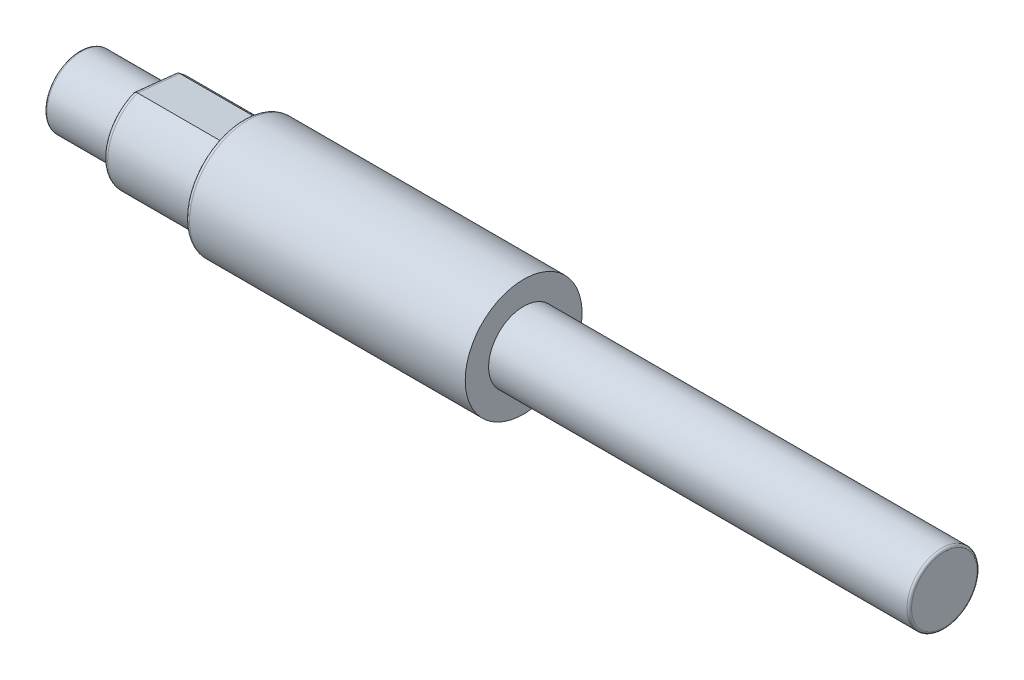
from build123d import *

# Parameters (mm, degrees)
SKETCH_1_R      = 1.5
EXTRUDE_1_DEPTH = 37
EXTRUDE_START   = -7
SKETCH_2_R      = 2.5
SKETCH_2_R_2    = 1
EXTRUDE_2_DEPTH = 12
EXTRUDE_START_2 = 3
SKETCH_3_R      = 1
EXTRUDE_4_DEPTH = 4
FILLET_1_R      = 0.1
FILLET_2_R      = 0.2


with BuildPart() as part:
    # 草图1 → 凸台-拉伸1 (new body)
    with BuildSketch(Plane(origin=(0, 0, 0), x_dir=(0, 0, -1), z_dir=(1, 0, 0))):
        Circle(SKETCH_1_R)
    extrude(amount=EXTRUDE_1_DEPTH)

    # 草图2 → 凸台-拉伸2 (add)
    with BuildSketch(Plane.ZY.offset(EXTRUDE_START)):
        Circle(SKETCH_2_R)
        Circle(SKETCH_2_R_2, mode=Mode.SUBTRACT)
    extrude(amount=-EXTRUDE_2_DEPTH)

    # 草图3 → 凸台-拉伸4 (add)
    with BuildSketch(Plane(origin=(0, 0, 0), x_dir=(0, 0, -1), z_dir=(1, 0, 0)).offset(EXTRUDE_START_2)):
        with BuildLine():
            Line((1.093724045, 1.674445494), (-0.720042675, 1.865888139))
            ThreePointArc((-0.720042675, 1.865888139), (-0.209933354, -1.988951479), (1.093724045, 1.674445494))
        make_face()
        Circle(SKETCH_3_R, mode=Mode.SUBTRACT)
    extrude(amount=EXTRUDE_4_DEPTH)

    # 圆角1
    fillet_1_edges = [part.edges().sort_by_distance(p)[0] for p in [
        (0, 0, 1.5),
        (37, 0, 1.5),
    ]]
    fillet(fillet_1_edges, radius=FILLET_1_R)

    # 圆角2
    fillet_2_edges = [part.edges().sort_by_distance(p)[0] for p in [
        (3, -1.988951479, 0.209933354),
        (3, 1.770166817, -0.186840685),
        (7, 0, -2.5),
    ]]
    fillet(fillet_2_edges, radius=FILLET_2_R)


solid = part.part
